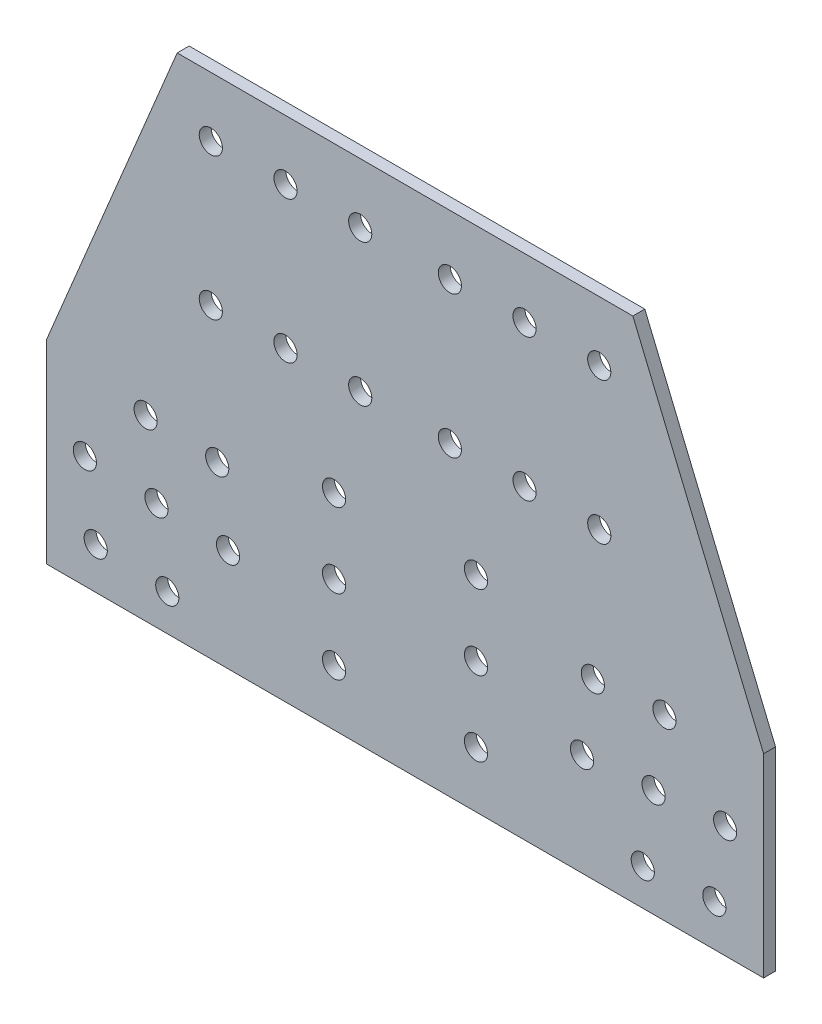
from build123d import *

# Parameters (mm, degrees)
EXTRUDE_2_DEPTH     = 16
SKETCH_2_R          = 15.5
CUT_EXTRUDE_3_DEPTH = 965.699401752


with BuildPart() as part:
    # 草图1 → 拉伸2 (new body)
    with BuildSketch(Plane.XY):
        Polygon((693.325362834, 420), (83.325362834, 420), (-91.674637166, 0), (-91.674637166, -260), (868.325362834, -260), (868.325362834, 0), align=None)
    extrude(amount=EXTRUDE_2_DEPTH)

    # 草图2 → 拉伸3 (cut, through all)
    with BuildSketch(Plane.XY.offset(16)):
        with Locations((328.325362834, 340)):
            Circle(SKETCH_2_R)
        with Locations((228.325362834, 340)):
            Circle(SKETCH_2_R)
        with Locations((128.325362834, 340)):
            Circle(SKETCH_2_R)
        with Locations(Location((128.325362834, 150, 0), (0, 0, 180))):
            Circle(SKETCH_2_R)
        with Locations(Location((228.325362834, 150, 0), (0, 0, 180))):
            Circle(SKETCH_2_R)
        with Locations(Location((328.325362834, 150, 0), (0, 0, 180))):
            Circle(SKETCH_2_R)
        with Locations((293.325362834, -185)):
            Circle(SKETCH_2_R)
        with Locations((293.325362834, 15)):
            Circle(SKETCH_2_R)
        with Locations((293.325362834, -85)):
            Circle(SKETCH_2_R)
        with Locations((639.758349024, -27.804790016)):
            Circle(SKETCH_2_R)
        with Locations((721.084382293, -116.043536113)):
            Circle(SKETCH_2_R)
        with Locations((802.410415562, -204.28228221)):
            Circle(SKETCH_2_R)
        with Locations((735.570581969, -21.095392271)):
            Circle(SKETCH_2_R)
        with Locations((706.598182617, -210.991679954)):
            Circle(SKETCH_2_R)
        with Locations(Location((625.272149348, -122.752933857, 0), (0, 0, 180))):
            Circle(SKETCH_2_R)
        with Locations(Location((816.896615238, -109.334138368, 0), (0, 0, 180))):
            Circle(SKETCH_2_R)
        with Locations((151.37857632, -122.752933857)):
            Circle(SKETCH_2_R)
        with Locations(Location((70.052543051, -210.991679954, 0), (0, 0, 180))):
            Circle(SKETCH_2_R)
        with Locations(Location((-25.759689894, -204.28228221, 0), (0, 0, 180))):
            Circle(SKETCH_2_R)
        with Locations(Location((55.566343375, -116.043536113, 0), (0, 0, 180))):
            Circle(SKETCH_2_R)
        with Locations(Location((136.892376644, -27.804790016, 0), (0, 0, 180))):
            Circle(SKETCH_2_R)
        with Locations((-40.24588957, -109.334138368)):
            Circle(SKETCH_2_R)
        with Locations(Location((41.080143699, -21.095392271, 0), (0, 0, 180))):
            Circle(SKETCH_2_R)
        with Locations((448.325362834, 150)):
            Circle(SKETCH_2_R)
        with Locations((548.325362834, 150)):
            Circle(SKETCH_2_R)
        with Locations((648.325362834, 150)):
            Circle(SKETCH_2_R)
        with Locations(Location((648.325362834, 340, 0), (0, 0, 180))):
            Circle(SKETCH_2_R)
        with Locations(Location((548.325362834, 340, 0), (0, 0, 180))):
            Circle(SKETCH_2_R)
        with Locations(Location((448.325362834, 340, 0), (0, 0, 180))):
            Circle(SKETCH_2_R)
        with Locations(Location((483.325362834, -85, 0), (0, 0, 180))):
            Circle(SKETCH_2_R)
        with Locations(Location((483.325362834, 15, 0), (0, 0, 180))):
            Circle(SKETCH_2_R)
        with Locations(Location((483.325362834, -185, 0), (0, 0, 180))):
            Circle(SKETCH_2_R)
    extrude(amount=-CUT_EXTRUDE_3_DEPTH, mode=Mode.SUBTRACT)


solid = part.part
